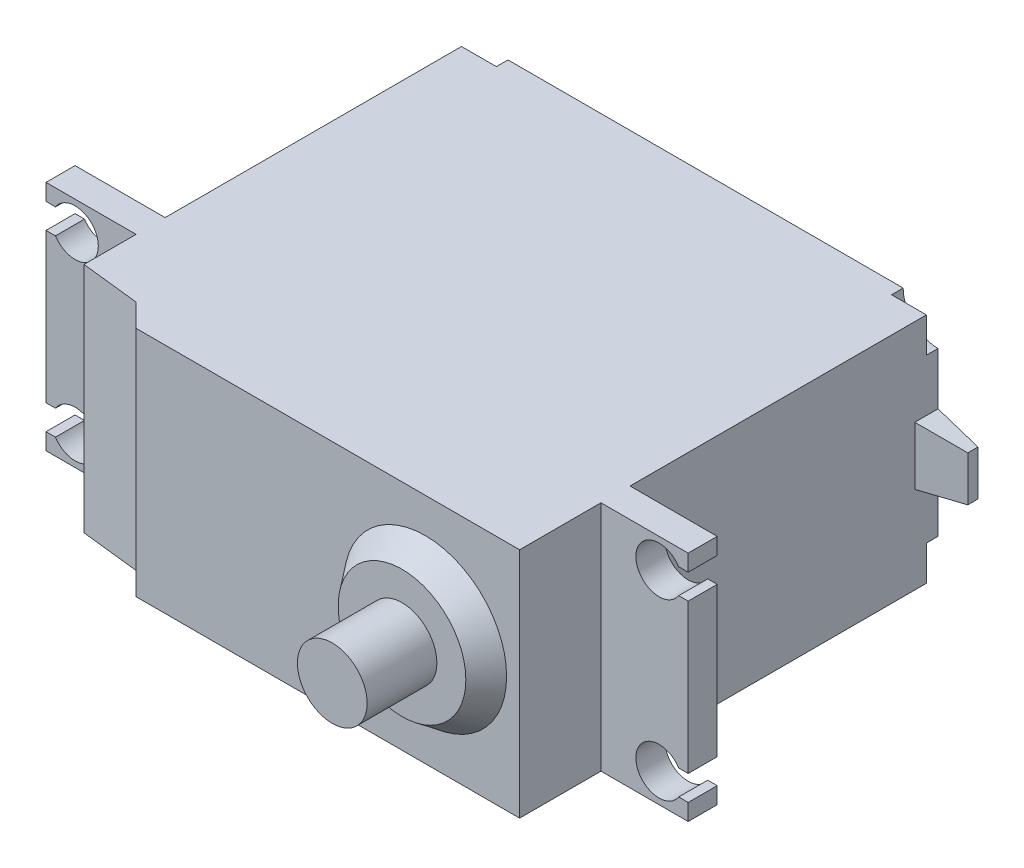
from build123d import *

# Parameters (mm, degrees)
SKETCH2_W           = 40
SKETCH2_H           = 20
EXTRUDE1_DEPTH      = 36
EXTRUDE2_DEPTH      = 7.75
EXTRUDE2_DEPTH_BACK = 47.5
SKETCH3_W           = 2.5
SKETCH3_H           = 20
EXTRUDE3_DEPTH      = 1
SKETCH5_W           = 2
SKETCH5_H           = 5
EXTRUDE4_DEPTH      = 4
EXTRUDE4_TAPER      = 8
EXTRUDE7_DEPTH      = 24
EXTRUDE7_DEPTH_BACK = 12
SKETCH8_R           = 7
EXTRUDE8_DEPTH      = 2
EXTRUDE8_TAPER      = 37
EXTRUDE9_DEPTH      = 15
EXTRUDE9_DEPTH_BACK = 24
SKETCH10_R          = 3
EXTRUDE10_DEPTH     = 6


with BuildPart() as part:
    # Sketch2 → Extrude1 (new body)
    with BuildSketch(Plane.XY):
        with Locations((20, 10)):
            Rectangle(SKETCH2_W, SKETCH2_H)
    extrude(amount=EXTRUDE1_DEPTH)

    # Sketch3 → Extrude2 (add, two sides: drawn at the far end of the back side and taken through both)
    with BuildSketch(Plane.ZY.offset(-EXTRUDE2_DEPTH_BACK)):
        with Locations((27.75, 10)):
            Rectangle(SKETCH3_W, SKETCH3_H)
    extrude(amount=EXTRUDE2_DEPTH + EXTRUDE2_DEPTH_BACK)

    # Sketch4 → Extrude3 (cut)
    with BuildSketch(Plane(origin=(0, 0, 0), x_dir=(-1, 0, 0), z_dir=(0, 0, -1))):
        with BuildLine():
            Line((-37, 20), (-40, 20))
            Line((-40, 20), (-40, 17))
            ThreePointArc((-40, 17), (-37.878679656, 17.878679656), (-37, 20))
        make_face()
        with BuildLine():
            Line((-40, 3), (-40, 0))
            Line((-40, 0), (-37, 0))
            ThreePointArc((-37, 0), (-37.878679656, 2.121320344), (-40, 3))
        make_face()
        with BuildLine():
            Line((0, 3), (0, 0))
            Line((0, 0), (-3, 0))
            ThreePointArc((-3, 0), (-2.121320344, 2.121320344), (0, 3))
        make_face()
        with BuildLine():
            Line((0, 17), (0, 20))
            Line((0, 20), (-3, 20))
            ThreePointArc((-3, 20), (-2.121320344, 17.878679656), (0, 17))
        make_face()
    extrude(amount=-EXTRUDE3_DEPTH, mode=Mode.SUBTRACT)

    # Sketch6 → Extrude7 (cut, two sides: drawn at the far end of the back side and taken through both)
    with BuildSketch(Plane.XY.offset(29).offset(-EXTRUDE7_DEPTH_BACK)):
        with BuildLine():
            Line((-6.93456787, 3.578068222), (-7.75, 3.578068222))
            Line((-7.75, 3.578068222), (-7.75, 1.421931778))
            Line((-7.75, 1.421931778), (-6.93456787, 1.421931778))
            ThreePointArc((-6.93456787, 1.421931778), (-3.25, 2.5), (-6.93456787, 3.578068222))
        make_face()
        with BuildLine():
            Line((46.68456787, 18.578068222), (47.5, 18.578068222))
            Line((47.5, 18.578068222), (47.5, 16.421931778))
            Line((47.5, 16.421931778), (46.68456787, 16.421931778))
            ThreePointArc((46.68456787, 16.421931778), (43, 17.5), (46.68456787, 18.578068222))
        make_face()
        with BuildLine():
            ThreePointArc((46.68456787, 1.421931778), (43, 2.5), (46.68456787, 3.578068222))
            Line((46.68456787, 3.578068222), (47.5, 3.578068222))
            Line((47.5, 3.578068222), (47.5, 1.421931778))
            Line((47.5, 1.421931778), (46.68456787, 1.421931778))
        make_face()
        with BuildLine():
            ThreePointArc((-6.93456787, 16.421931778), (-3.25, 17.5), (-6.93456787, 18.578068222))
            Line((-6.93456787, 18.578068222), (-7.75, 18.578068222))
            Line((-7.75, 18.578068222), (-7.75, 16.421931778))
            Line((-7.75, 16.421931778), (-6.93456787, 16.421931778))
        make_face()
    extrude(amount=EXTRUDE7_DEPTH + EXTRUDE7_DEPTH_BACK, mode=Mode.SUBTRACT)

    # Sketch8 → Extrude8 (add)
    with BuildSketch(Plane.XY.offset(36)):
        with Locations((31.880492546, 10)):
            Circle(SKETCH8_R)
    extrude(amount=EXTRUDE8_DEPTH, taper=EXTRUDE8_TAPER)

    # Sketch9 → Extrude9 (cut, two sides: drawn at the far end of the back side and taken through both)
    with BuildSketch(Plane.XZ.offset(-EXTRUDE9_DEPTH_BACK)):
        Polygon((7, 36), (5.046113412, 34.046113412), (0, 33.479218226), (0, 34.046113412), (0, 36), align=None)
    extrude(amount=EXTRUDE9_DEPTH + EXTRUDE9_DEPTH_BACK, mode=Mode.SUBTRACT)

    # Sketch10 → Extrude10 (add)
    with BuildSketch(Plane.XY.offset(38)):
        with Locations((31.880492546, 10)):
            Circle(SKETCH10_R)
    extrude(amount=EXTRUDE10_DEPTH)


with BuildPart() as body_2:
    # Sketch5 → Extrude4 (new body)
    with BuildSketch(Plane(origin=(40, 0, 0), x_dir=(0, 0, -1), z_dir=(1, 0, 0))):
        with Locations((-1, 10)):
            Rectangle(SKETCH5_W, SKETCH5_H)
    extrude(amount=EXTRUDE4_DEPTH, taper=EXTRUDE4_TAPER)


solid = Compound([part.part, body_2.part])
